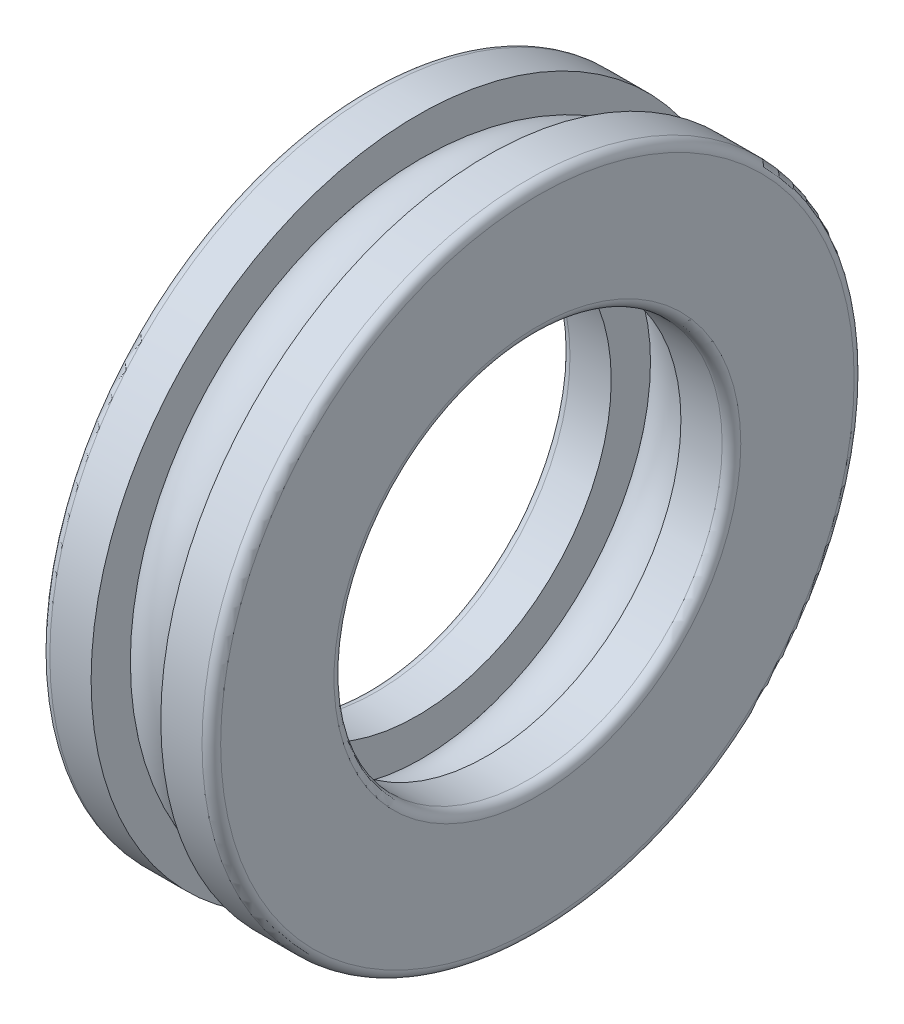
from build123d import *

# Parameters (mm, degrees)
BALSIMSKE_R = 2.805


with BuildPart() as part:
    # InnRacSke → Race (revolve)
    with BuildSketch(Plane.XY, mode=Mode.PRIVATE) as race_sk:
        with BuildLine():
            Line((-2.244, 15.10900518), (-2.244, 12.5))
            Line((-2.244, 12.5), (-4.9, 12.5))
            ThreePointArc((-4.9, 12.5), (-5.324264069, 12.675735931), (-5.5, 13.1))
            Line((-5.5, 13.1), (-5.5, 20.4))
            ThreePointArc((-5.5, 20.4), (-5.324264069, 20.824264069), (-4.9, 21))
            Line((-4.9, 21), (-2.244, 21))
            Line((-2.244, 21), (-2.244, 18.39099482))
            ThreePointArc((-2.244, 18.39099482), (-2.78, 16.75), (-2.244, 15.10900518))
        make_face()
    race = revolve(race_sk.sketch.rotate(Axis((-34.925, 0, 0), (1, 0, 0)), 270), axis=Axis((-34.925, 0, 0), (1, 0, 0)))

    # BalSimSke → BallsSimplified (revolve)
    with BuildSketch(Plane.XY, mode=Mode.PRIVATE) as ballssimplified_sk:
        with Locations((0, 16.75)):
            Circle(BALSIMSKE_R)
    revolve(ballssimplified_sk.sketch.rotate(Axis((-25.4, 0, 0), (1, 0, 0)), 90), axis=Axis((-25.4, 0, 0), (1, 0, 0)))

    # Mirror1: Race across plane
    add(race.mirror(Plane(origin=(0, 0, 0), x_dir=(0, 0, 1), z_dir=(1, 0, 0))))


solid = part.part
